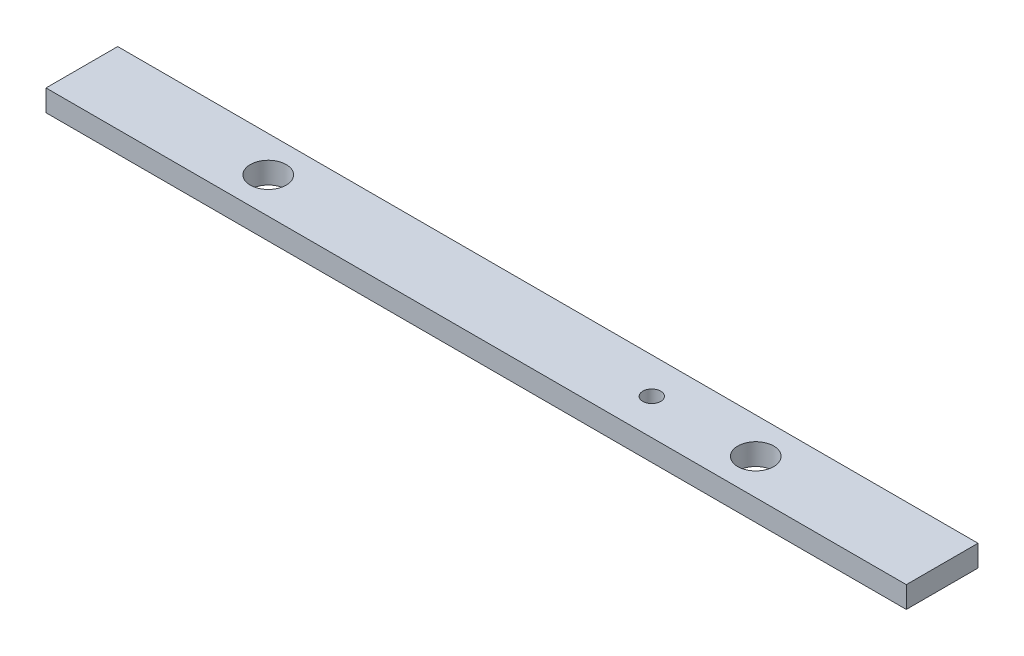
from build123d import *

# Parameters (mm, degrees)
SKETCH3_W           = 120
SKETCH3_H           = 10
BOSS_EXTRUDE1_DEPTH = 3
SKETCH5_R           = 2.5
SKETCH5_R_2         = 1.25
CUT_EXTRUDE1_DEPTH  = 3


with BuildPart() as part:
    # Sketch3 → Boss-Extrude1 (new body)
    with BuildSketch(Plane(origin=(0, 0, 0), x_dir=(1, 0, 0), z_dir=(0, 1, 0))):
        Rectangle(SKETCH3_W, SKETCH3_H)
    extrude(amount=BOSS_EXTRUDE1_DEPTH)

    # Sketch5 → Cut-Extrude1 (cut)
    with BuildSketch(Plane(origin=(0, 0, 0), x_dir=(1, 0, 0), z_dir=(0, 1, 0))):
        with Locations(Location((-34, 0, 0), (0, 0, 90))):
            Circle(SKETCH5_R)
        with Locations(Location((34, 0, 0), (0, 0, 90))):
            Circle(SKETCH5_R)
        with Locations(Location((19.5, 0, 0), (0, 0, 90))):
            Circle(SKETCH5_R_2)
    extrude(amount=CUT_EXTRUDE1_DEPTH, mode=Mode.SUBTRACT)


solid = part.part
